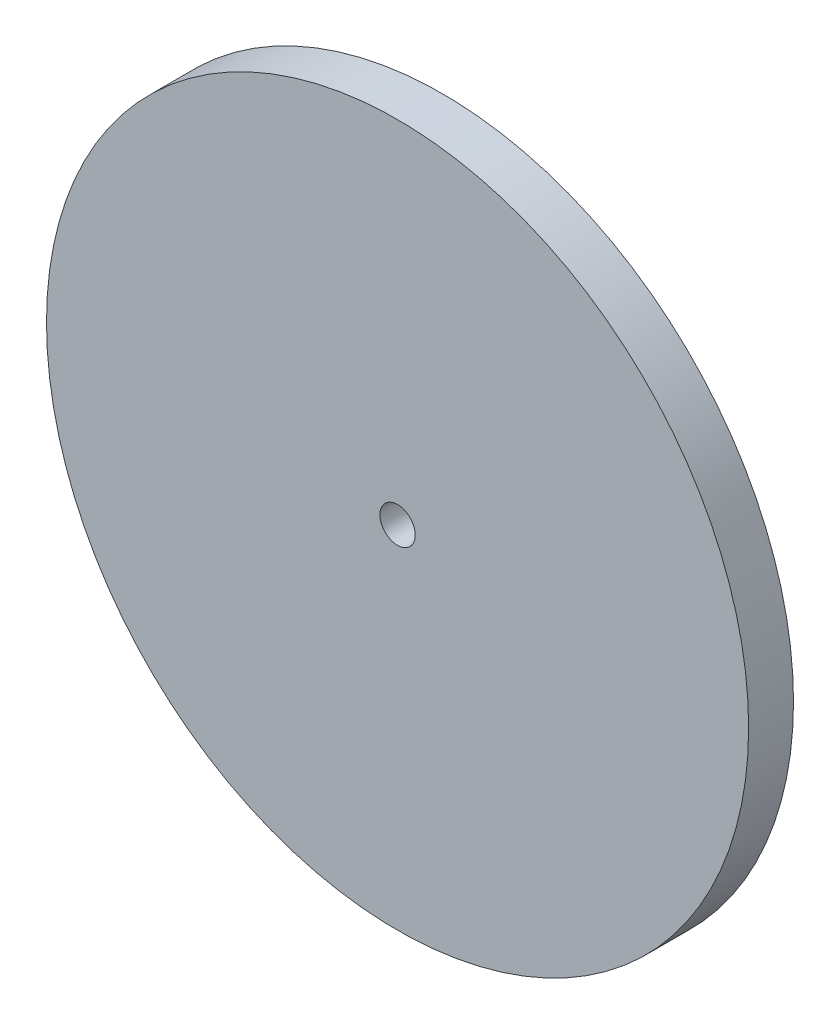
from build123d import *

# Parameters (mm, degrees)
SKETCH1_R           = 39.75
BOSS_EXTRUDE1_DEPTH = 5.08
SKETCH2_R           = 2
CUT_EXTRUDE1_DEPTH  = 10


with BuildPart() as part:
    # Sketch1 → Boss-Extrude1 (new body)
    with BuildSketch(Plane.XY):
        Circle(SKETCH1_R)
    extrude(amount=BOSS_EXTRUDE1_DEPTH)

    # Sketch2 → Cut-Extrude1 (cut)
    with BuildSketch(Plane.XY.offset(5.08)):
        Circle(SKETCH2_R)
    extrude(amount=-CUT_EXTRUDE1_DEPTH, mode=Mode.SUBTRACT)


solid = part.part
